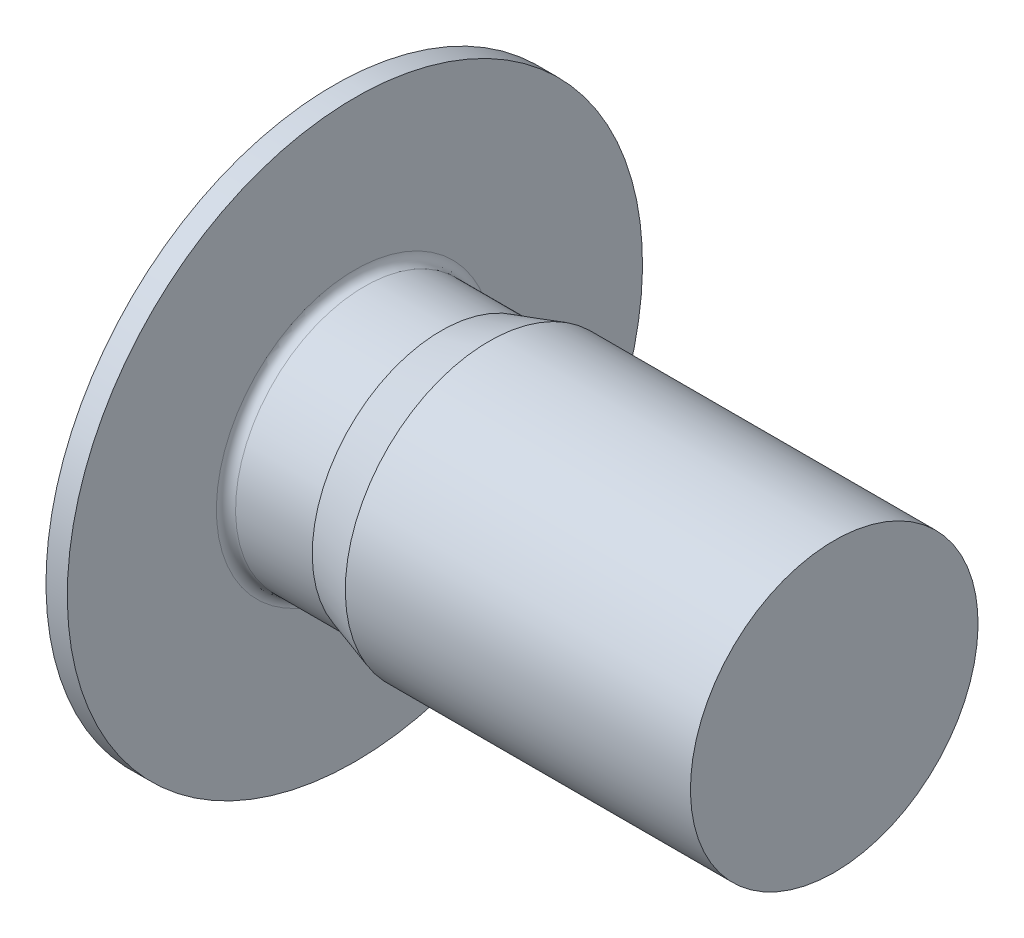
from build123d import *

# Parameters (mm, degrees)
FILLET1_R          = 0.1
CUT_EXTRUDE1_DEPTH = 2


with BuildPart() as part:
    # Sketch1 → Revolve1 (revolve)
    with BuildSketch(Plane.XY, mode=Mode.PRIVATE) as revolve1_sk:
        Polygon((-0.8, 0), (-0.8, 2), (-0.222649731, 3), (0, 3), (0, 1.345), (0.9, 1.345), (1.4, 1.5), (5, 1.5), (5, 0), align=None)
    revolve(revolve1_sk.sketch.rotate(Axis((-0.8, 0, 0), (1, 0, 0)), 180), axis=Axis((-0.8, 0, 0), (1, 0, 0)))

    # Fillet1
    fillet1_edges = [part.edges().sort_by_distance(p)[0] for p in [
        (0, 1.345, 0),
    ]]
    fillet(fillet1_edges, radius=FILLET1_R)

    # Sketch2 → Cut-Extrude1 (cut)
    with BuildSketch(Plane.ZY.offset(0.8)):
        Polygon((0, 0.866025404), (-0.75, 0.433012702), (-0.75, -0.433012702), (0, -0.866025404), (0.75, -0.433012702), (0.75, 0.433012702), align=None)
    extrude(amount=-CUT_EXTRUDE1_DEPTH, mode=Mode.SUBTRACT)

    # Sketch3 → Cut-Revolve1 (revolve, cut)
    with BuildSketch(Plane.XY, mode=Mode.PRIVATE) as cut_revolve1_sk:
        Polygon((1.2, 0), (1.2, 0.75), (1.650645464, 0), align=None)
    revolve(cut_revolve1_sk.sketch.rotate(Axis((1.2, 0, 0), (1, 0, 0)), 180), axis=Axis((1.2, 0, 0), (1, 0, 0)), mode=Mode.SUBTRACT)


solid = part.part
